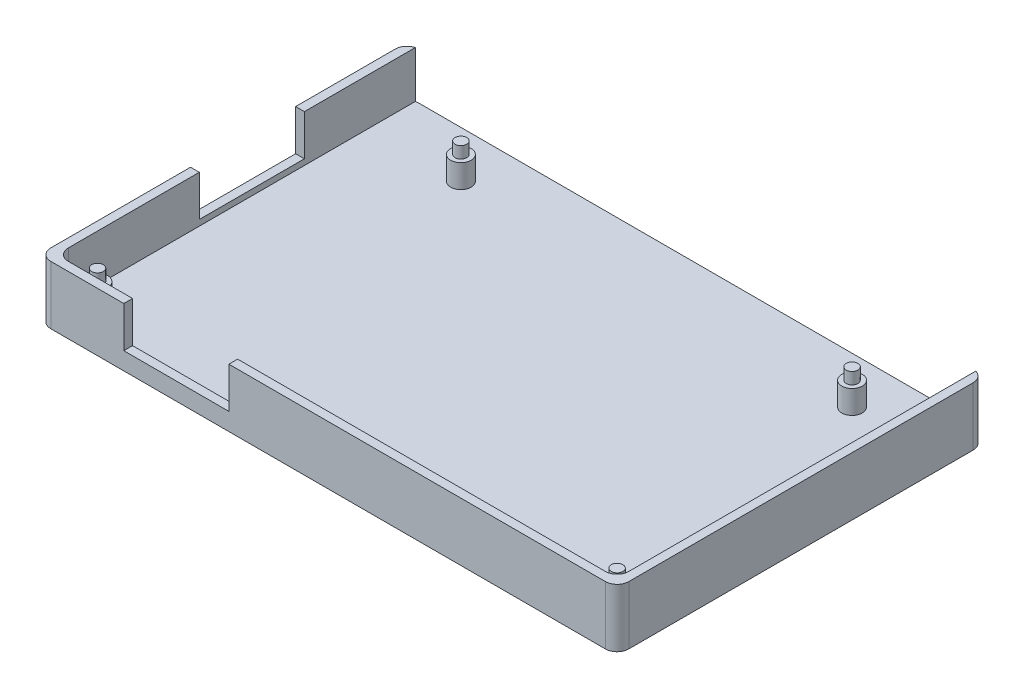
from build123d import *

# Parameters (mm, degrees)
SKETCH1_R             = 1
BOSS_EXTRUDE1_DEPTH   = 8
BOSS_EXTRUDE1_2_DEPTH = 8
BOSS_EXTRUDE1_3_DEPTH = 8
BOSS_EXTRUDE1_4_DEPTH = 8
SKETCH2_R             = 1.75
BOSS_EXTRUDE2_DEPTH   = 6
SKETCH3_W             = 99
SKETCH3_H             = 63
BOSS_EXTRUDE3_DEPTH   = 2
FILLET1_R             = 2
BOSS_EXTRUDE4_START   = 8
BOSS_EXTRUDE4_DEPTH   = 8
CUT_EXTRUDE1_REACH    = 106.833
SKETCH6_W             = 18
SKETCH6_H             = 7
CUT_EXTRUDE2_REACH    = 83.514
SKETCH8_W             = 18
SKETCH8_H             = 7


with BuildPart() as part:
    # Sketch1 → Boss-Extrude1 (new body)
    with BuildSketch(Plane(origin=(0, 0, 0), x_dir=(1, 0, 0), z_dir=(0, 1, 0))):
        with Locations(Location((-33.5, 25, 0), (0, 0, 270))):
            Circle(SKETCH1_R)
    extrude(amount=BOSS_EXTRUDE1_DEPTH)



with BuildPart() as body_2:
    # Sketch1 → Boss-Extrude1 2 (new body)
    with BuildSketch(Plane(origin=(0, 0, 0), x_dir=(1, 0, 0), z_dir=(0, 1, 0))):
        with Locations(Location((33.5, 25, 0), (0, 0, 270))):
            Circle(SKETCH1_R)
    extrude(amount=BOSS_EXTRUDE1_2_DEPTH)


with BuildPart() as body_3:
    # Sketch1 → Boss-Extrude1 3 (new body)
    with BuildSketch(Plane(origin=(0, 0, 0), x_dir=(1, 0, 0), z_dir=(0, 1, 0))):
        with Locations(Location((-45.75, -25, 0), (0, 0, 270))):
            Circle(SKETCH1_R)
    extrude(amount=BOSS_EXTRUDE1_3_DEPTH)


with BuildPart() as body_4:
    # Sketch1 → Boss-Extrude1 4 (new body)
    with BuildSketch(Plane(origin=(0, 0, 0), x_dir=(1, 0, 0), z_dir=(0, 1, 0))):
        with Locations(Location((43.25, -25, 0), (0, 0, 270))):
            Circle(SKETCH1_R)
    extrude(amount=BOSS_EXTRUDE1_4_DEPTH)


with BuildPart() as part_1:
    add(part.part)

    add(body_2.part)  # Boss-Extrude2 merges body 2

    add(body_3.part)  # Boss-Extrude2 merges body 3

    add(body_4.part)  # Boss-Extrude2 merges body 4
    # Sketch2 → Boss-Extrude2 (add)
    with BuildSketch(Plane(origin=(0, 0, 0), x_dir=(1, 0, 0), z_dir=(0, 1, 0))):
        with Locations(Location((-33.5, 25, 0), (0, 0, 270))):
            Circle(SKETCH2_R)
        with Locations(Location((33.5, 25, 0), (0, 0, 270))):
            Circle(SKETCH2_R)
        with Locations(Location((43.25, -25, 0), (0, 0, 270))):
            Circle(SKETCH2_R)
        with Locations(Location((-45.75, -25, 0), (0, 0, 270))):
            Circle(SKETCH2_R)
    extrude(amount=BOSS_EXTRUDE2_DEPTH)

    # Sketch3 → Boss-Extrude3 (add)
    with BuildSketch(Plane(origin=(0, 0, 0), x_dir=(1, 0, 0), z_dir=(0, 1, 0))):
        with Locations((-1.25, 1.5)):
            Rectangle(SKETCH3_W, SKETCH3_H)
    extrude(amount=BOSS_EXTRUDE3_DEPTH)

    # Fillet1
    fillet1_edges = [part_1.edges().sort_by_distance(p)[0] for p in [
        (-50.75, 1, -33),
        (-50.75, 1, 30),
        (48.25, 1, 30),
        (48.25, 1, -33),
    ]]
    fillet(fillet1_edges, radius=FILLET1_R)

    # Sketch4 → Boss-Extrude4 (add)
    with BuildSketch(Plane(origin=(0, 2, 0), x_dir=(1, 0, 0), z_dir=(0, 1, 0)).offset(BOSS_EXTRUDE4_START)):
        with BuildLine():
            Line((-47.25, -28.5), (44.75, -28.5))
            ThreePointArc((44.75, -28.5), (46.164213562, -27.914213562), (46.75, -26.5))
            Line((46.75, -26.5), (46.75, 32.936491673))
            ThreePointArc((46.75, 32.936491673), (47.83113883, 32.224744871), (48.25, 31))
            Line((48.25, 31), (48.25, -28))
            ThreePointArc((48.25, -28), (47.664213562, -29.414213562), (46.25, -30))
            Line((46.25, -30), (-48.75, -30))
            ThreePointArc((-48.75, -30), (-50.164213562, -29.414213562), (-50.75, -28))
            Line((-50.75, -28), (-50.75, 31))
            ThreePointArc((-50.75, 31), (-50.33113883, 32.224744871), (-49.25, 32.936491673))
            Line((-49.25, 32.936491673), (-49.25, -26.5))
            ThreePointArc((-49.25, -26.5), (-48.664213562, -27.914213562), (-47.25, -28.5))
        make_face()
    extrude(amount=-BOSS_EXTRUDE4_DEPTH)

    # Sketch6 → Cut-Extrude1 (cut, up to next)
    with BuildSketch(Plane.ZY.offset(50.75), mode=Mode.PRIVATE) as cut_extrude1_sk1:
        with Locations((-4.936491673, 6.5)):
            Rectangle(SKETCH6_W, SKETCH6_H)
    cut_extrude1_tool1 = extrude(cut_extrude1_sk1.sketch, amount=-CUT_EXTRUDE1_REACH, mode=Mode.PRIVATE) & part_1.part
    add(cut_extrude1_tool1.solids().sort_by_distance((-50.75, 6.5, -4.936492))[0], mode=Mode.SUBTRACT)

    # Sketch8 → Cut-Extrude2 (cut, up to next)
    with BuildSketch(Plane.XY.offset(30), mode=Mode.PRIVATE) as cut_extrude2_sk1:
        with Locations((-27.25, 6.5)):
            Rectangle(SKETCH8_W, SKETCH8_H)
    cut_extrude2_tool1 = extrude(cut_extrude2_sk1.sketch, amount=-CUT_EXTRUDE2_REACH, mode=Mode.PRIVATE) & part_1.part
    add(cut_extrude2_tool1.solids().sort_by_distance((-27.25, 6.5, 30))[0], mode=Mode.SUBTRACT)


solid = part_1.part
